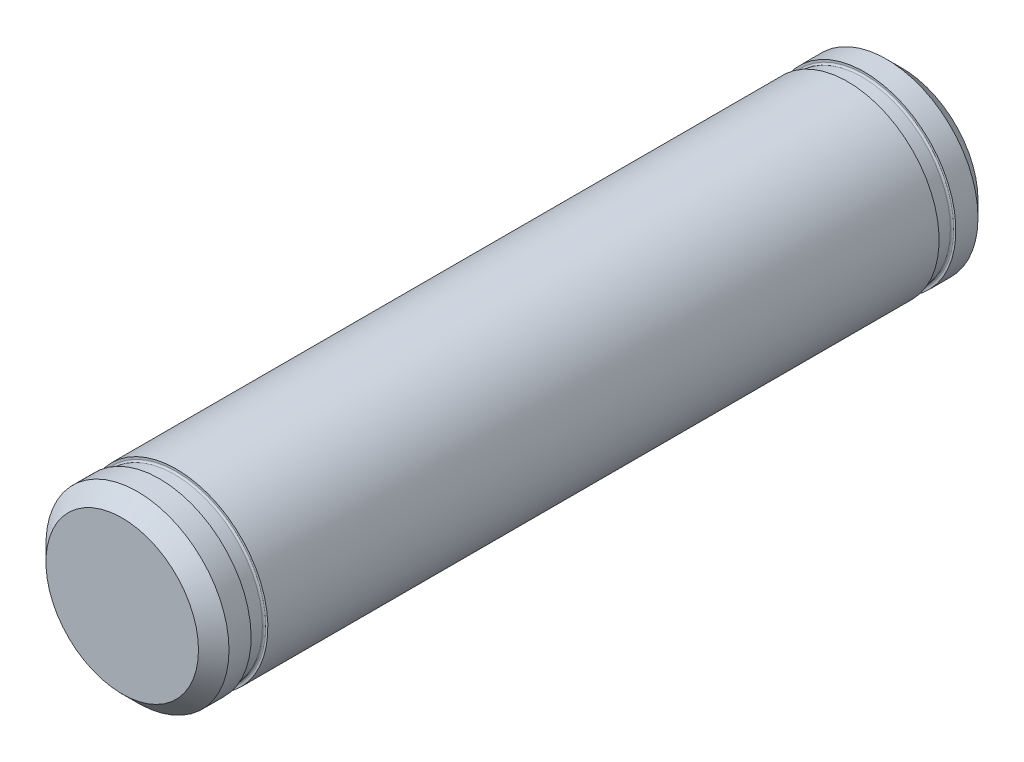
from build123d import *

# Parameters (mm, degrees)
SKETCH1_R           = 6
BOSS_EXTRUDE1_DEPTH = 51.1
CHAMFER1_SIZE       = 1


with BuildPart() as part:
    # Sketch1 → Boss-Extrude1 (new body)
    with BuildSketch(Plane.XY):
        Circle(SKETCH1_R)
    extrude(amount=BOSS_EXTRUDE1_DEPTH)

    # Chamfer1
    chamfer1_edges = [part.edges().sort_by_distance(p)[0] for p in [
        (-6, 0, 0),
        (-6, 0, 51.1),
    ]]
    chamfer(chamfer1_edges, length=CHAMFER1_SIZE)

    # Groove Sketch → Retaining Ring Groove (revolve, cut)
    with BuildSketch(Plane(origin=(11.571093486, 1.818413045, 30.848914431), x_dir=(-0.1670407778174849, -0.02625068493329621, 0.9856004667646331), z_dir=(0.1552460285814813, -0.987875837648476, 0)), mode=Mode.PRIVATE) as retaining_ring_groove_sk:
        with BuildLine():
            Line((20.516209746, 14.310059643), (20.539882467, 14.448043709))
            Line((20.539882467, 14.448043709), (19.455721954, 14.634043658))
            Line((19.455721954, 14.634043658), (19.432049233, 14.496059593))
            ThreePointArc((19.432049233, 14.496059593), (19.450651377, 14.413950055), (19.521865289, 14.369043546))
            Line((19.521865289, 14.369043546), (20.3891937, 14.220243587))
            ThreePointArc((20.3891937, 14.220243587), (20.471303237, 14.238845731), (20.516209746, 14.310059643))
        make_face()
    revolve(retaining_ring_groove_sk.sketch.rotate(Axis((0, 0, 39.317134261), (0, 0, -1)), 98.931065378), axis=Axis((0, 0, 39.317134261), (0, 0, -1)), mode=Mode.SUBTRACT)

    # Groove Sketch1 → Retaining Ring Groove1 (revolve, cut)
    with BuildSketch(Plane(origin=(11.571093486, 1.818413045, 30.848914431), x_dir=(-0.16704077781748494, -0.02625068493329602, 0.9856004667646331), z_dir=(0.1552460285814813, -0.987875837648476, 0)), mode=Mode.PRIVATE) as retaining_ring_groove1_sk:
        with BuildLine():
            Line((-23.934371305, 21.93605756), (-23.910698584, 22.074041625))
            Line((-23.910698584, 22.074041625), (-24.994859097, 22.260041574))
            Line((-24.994859097, 22.260041574), (-25.018531818, 22.122057509))
            ThreePointArc((-25.018531818, 22.122057509), (-24.999929675, 22.039947971), (-24.928715762, 21.995041463))
            Line((-24.928715762, 21.995041463), (-24.061387351, 21.846241503))
            ThreePointArc((-24.061387351, 21.846241503), (-23.979277814, 21.864843647), (-23.934371305, 21.93605756))
        make_face()
    revolve(retaining_ring_groove1_sk.sketch.rotate(Axis((0, 0, 39.317134261), (0, 0, -1)), 8.931065378), axis=Axis((0, 0, 39.317134261), (0, 0, -1)), mode=Mode.SUBTRACT)


solid = part.part
